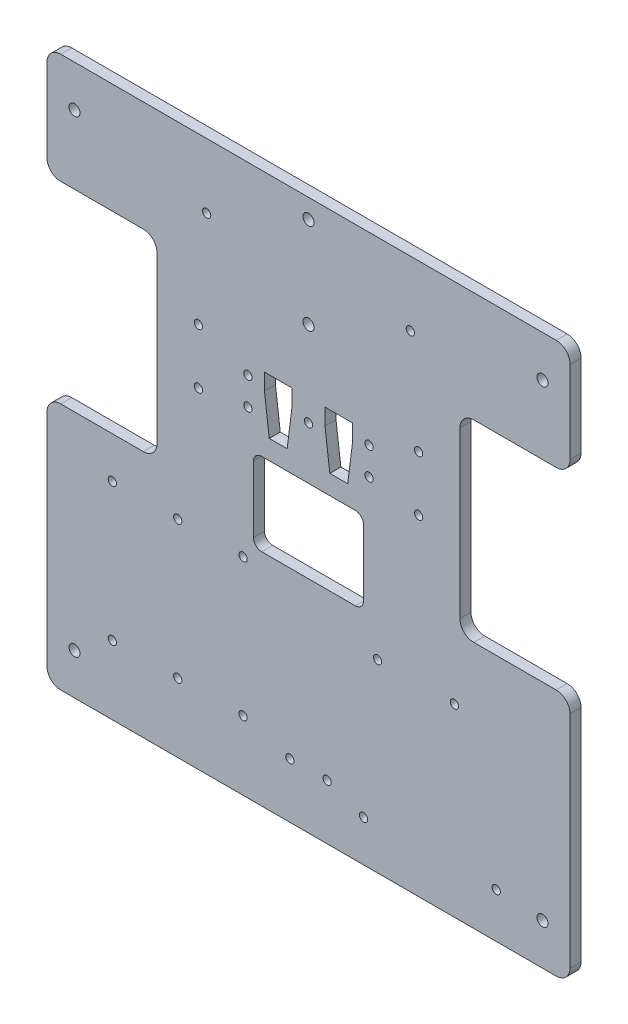
from build123d import *

# Parameters (mm, degrees)
BOSS_EXTRUDE1_DEPTH = 4
SKETCH2_R           = 2
SKETCH2_R_2         = 1.5
CUT_EXTRUDE1_DEPTH  = 20
SKETCH3_R           = 1.5
CUT_EXTRUDE2_DEPTH  = 10
SKETCH5_R           = 1.5
SKETCH5_R_2         = 2
CUT_EXTRUDE3_DEPTH  = 222.452026408
SKETCH7_R           = 1.5
CUT_EXTRUDE4_DEPTH  = 10


with BuildPart() as part:
    # Sketch1 → Boss-Extrude1 (new body)
    with BuildSketch(Plane.XY):
        with BuildLine():
            Line((-95, -115), (-95, -195))
            ThreePointArc((-95, -195), (-93.535533906, -198.535533906), (-90, -200))
            Line((-90, -200), (90, -200))
            ThreePointArc((90, -200), (93.535533906, -198.535533906), (95, -195))
            Line((95, -195), (95, -115))
            ThreePointArc((95, -115), (93.535533906, -111.464466094), (90, -110))
            Line((90, -110), (60, -110))
            ThreePointArc((60, -110), (56.464466094, -108.535533906), (55, -105))
            Line((55, -105), (55, -45))
            ThreePointArc((55, -45), (56.464466094, -41.464466094), (60, -40))
            Line((60, -40), (90, -40))
            ThreePointArc((90, -40), (93.535533906, -38.535533906), (95, -35))
            Line((95, -35), (95, -5))
            ThreePointArc((95, -5), (93.535533906, -1.464466094), (90, 0))
            Line((90, 0), (-90, 0))
            ThreePointArc((-90, 0), (-93.535533906, -1.464466094), (-95, -5))
            Line((-95, -5), (-95, -35))
            ThreePointArc((-95, -35), (-93.535533906, -38.535533906), (-90, -40))
            Line((-90, -40), (-60, -40))
            ThreePointArc((-60, -40), (-56.464466094, -41.464466094), (-55, -45))
            Line((-55, -45), (-55, -105))
            ThreePointArc((-55, -105), (-56.464466094, -108.535533906), (-60, -110))
            Line((-60, -110), (-90, -110))
            ThreePointArc((-90, -110), (-93.535533906, -111.464466094), (-95, -115))
        make_face()
    extrude(amount=BOSS_EXTRUDE1_DEPTH)

    # Sketch2 → Cut-Extrude1 (cut)
    with BuildSketch(Plane.XY.offset(4)):
        with Locations((-85, -185)):
            Circle(SKETCH2_R)
        with Locations((-85, -15)):
            Circle(SKETCH2_R)
        with Locations((85, -15)):
            Circle(SKETCH2_R)
        with Locations((85, -185)):
            Circle(SKETCH2_R)
        with Locations((-6.765, -180)):
            Circle(SKETCH2_R_2)
        with Locations((6.765, -180)):
            Circle(SKETCH2_R_2)
    extrude(amount=-CUT_EXTRUDE1_DEPTH, mode=Mode.SUBTRACT)

    # Sketch3 → Cut-Extrude2 (cut)
    with BuildSketch(Plane.XY.offset(4)):
        with Locations((-71.25, -75)):
            Circle(SKETCH3_R)
        with Locations((-71.25, -175)):
            Circle(SKETCH3_R)
        with Locations((-71.25, -125)):
            Circle(SKETCH3_R)
        with Locations((71.25, -75)):
            Circle(SKETCH3_R)
        with Locations((-23.75, -125)):
            Circle(SKETCH3_R)
        with Locations((-23.75, -175)):
            Circle(SKETCH3_R)
        with Locations((-47.5, -125)):
            Circle(SKETCH3_R)
        with Locations((-47.5, -175)):
            Circle(SKETCH3_R)
    extrude(amount=-CUT_EXTRUDE2_DEPTH, mode=Mode.SUBTRACT)

    # Sketch5 → Cut-Extrude3 (cut, through all)
    with BuildSketch(Plane.XY.offset(4)):
        with Locations((-40, -60)):
            Circle(SKETCH5_R)
        with Locations((-40, -80)):
            Circle(SKETCH5_R)
        with Locations(Location((40, -80, 0), (0, 0, 180))):
            Circle(SKETCH5_R)
        with Locations(Location((40, -60, 0), (0, 0, 180))):
            Circle(SKETCH5_R)
        with Locations((25.1, -132.9)):
            Circle(SKETCH5_R)
        with Locations((20, -185)):
            Circle(SKETCH5_R)
        with Locations((68.2, -183.7)):
            Circle(SKETCH5_R)
        with Locations((53, -132.9)):
            Circle(SKETCH5_R)
        with Locations((0, -7)):
            Circle(SKETCH5_R_2)
        with Locations((0, -40)):
            Circle(SKETCH5_R_2)
        with Locations((-37, -23.5)):
            Circle(SKETCH5_R)
        with Locations((37, -23.5)):
            Circle(SKETCH5_R)
    extrude(amount=-CUT_EXTRUDE3_DEPTH, mode=Mode.SUBTRACT)

    # Sketch7 → Cut-Extrude4 (cut)
    with BuildSketch(Plane(origin=(0, 0, 0), x_dir=(-1, 0, 0), z_dir=(0, 0, -1))):
        with Locations((22, -66.977361043)):
            Circle(SKETCH7_R)
        with Locations((22.009190814, -76.97735682)):
            Circle(SKETCH7_R)
        with Locations(Location((-22.009190814, -76.97735682, 0), (0, 0, 180))):
            Circle(SKETCH7_R)
        with Locations(Location((-22, -66.977361043, 0), (0, 0, 180))):
            Circle(SKETCH7_R)
        with Locations((0, -70.97735682)):
            Circle(SKETCH7_R)
        with BuildLine():
            Line((17, -120), (-17, -120))
            ThreePointArc((-17, -120), (-19.121320344, -119.121320344), (-20, -117))
            Line((-20, -117), (-20, -93))
            ThreePointArc((-20, -93), (-19.121320344, -90.878679656), (-17, -90))
            Line((-17, -90), (17, -90))
            ThreePointArc((17, -90), (19.121320344, -90.878679656), (20, -93))
            Line((20, -93), (20, -117))
            ThreePointArc((20, -117), (19.121320344, -119.121320344), (17, -120))
        make_face()
        Polygon((16, -62.977361043), (6, -62.977361043), (6, -68.977361043), (7.75, -82.977361043), (14.25, -82.977361043), (16, -68.977361043), align=None)
        Polygon((-6, -68.977361043), (-7.75, -82.977361043), (-14.25, -82.977361043), (-16, -68.977361043), (-16, -62.977361043), (-6, -62.977361043), align=None)
    extrude(amount=-CUT_EXTRUDE4_DEPTH, mode=Mode.SUBTRACT)


solid = part.part
